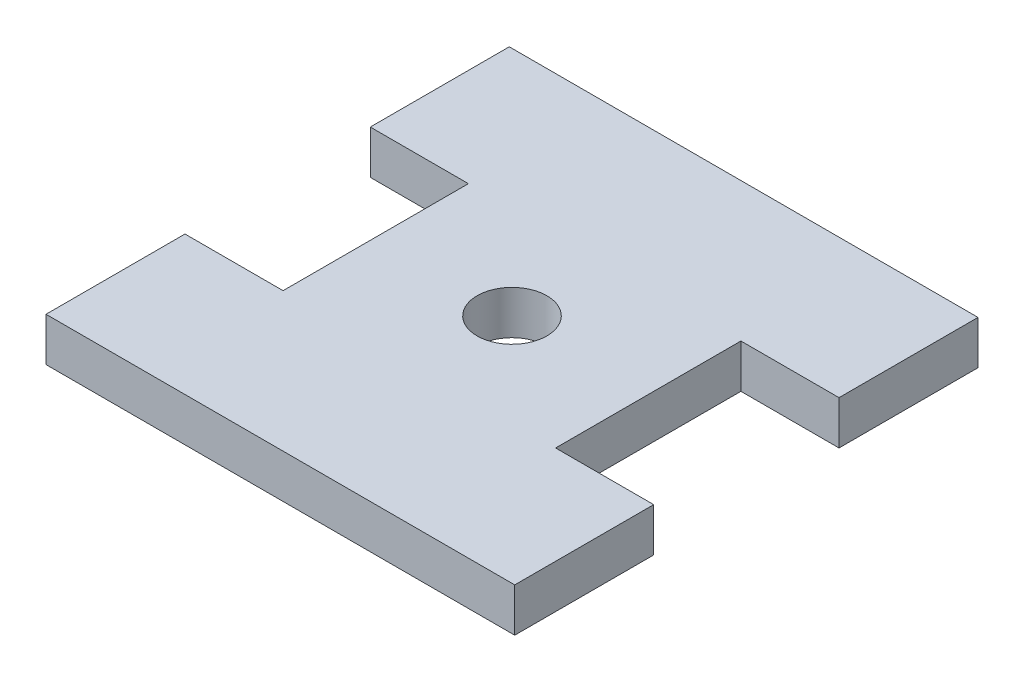
from build123d import *

# Parameters (mm, degrees)
SKETCH_1_W          = 43
SKETCH_1_H          = 42.5
SKETCH_1_R          = 3.2
EXTRUDE_1_DEPTH     = 4
SKETCH_2_W          = 9
SKETCH_2_H          = 17
CUT_EXTRUDE_1_DEPTH = 4


with BuildPart() as part:
    # Эскиз1 → Бобышка-Вытянуть1 (new body)
    with BuildSketch(Plane(origin=(0, 0, 0), x_dir=(1, 0, 0), z_dir=(0, 1, 0))):
        with Locations((36.826052882, -41.88992321)):
            Rectangle(SKETCH_1_W, SKETCH_1_H)
        with Locations(Location((36.826052882, -41.88992321, 0), (0, 0, 270))):
            Circle(SKETCH_1_R, mode=Mode.SUBTRACT)
    extrude(amount=EXTRUDE_1_DEPTH)

    # Эскиз2 → Вырез-Вытянуть1 (cut)
    with BuildSketch(Plane(origin=(0, 4, 0), x_dir=(1, 0, 0), z_dir=(0, 1, 0))):
        with Locations((19.826052882, -41.88992321)):
            Rectangle(SKETCH_2_W, SKETCH_2_H)
        with Locations((53.826052882, -41.88992321)):
            Rectangle(SKETCH_2_W, SKETCH_2_H)
    extrude(amount=-CUT_EXTRUDE_1_DEPTH, mode=Mode.SUBTRACT)


solid = part.part
